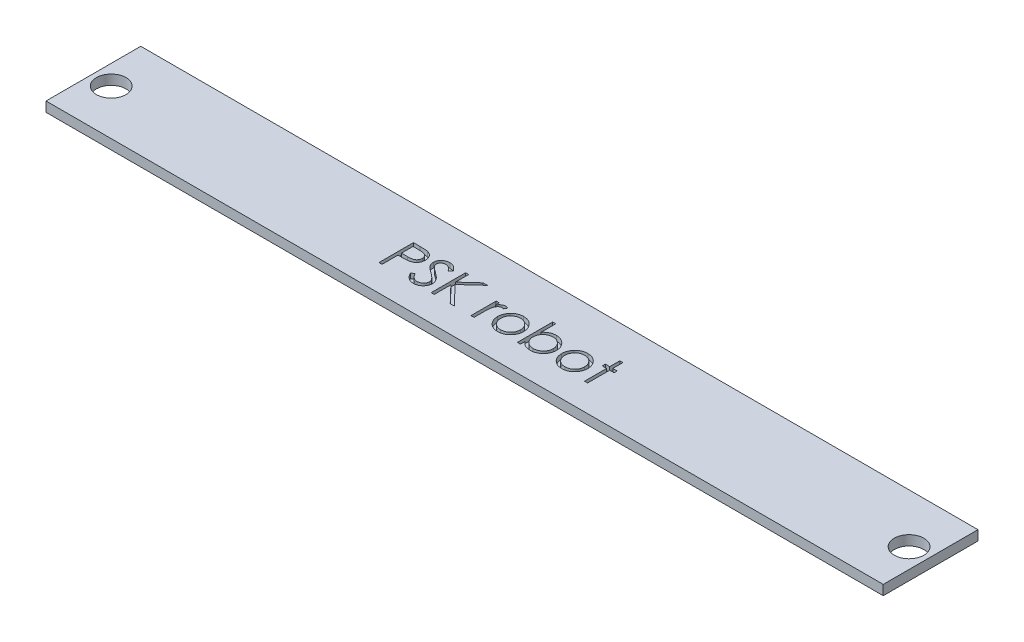
from build123d import *

# Parameters (mm, degrees)
SKETCH1_W           = 85
SKETCH1_H           = 9.62
SKETCH1_R           = 1.5
BOSS_EXTRUDE1_DEPTH = 1
CUT_EXTRUDE1_DEPTH  = 0.5


with BuildPart() as part:
    # Sketch1 → Boss-Extrude1 (new body)
    with BuildSketch(Plane(origin=(0, 0, 0), x_dir=(1, 0, 0), z_dir=(0, 1, 0))):
        Rectangle(SKETCH1_W, SKETCH1_H)
        with Locations(Location((-40.5, -0.19, 0), (0, 0, 270))):
            Circle(SKETCH1_R, mode=Mode.SUBTRACT)
        with Locations(Location((40.5, -0.19, 0), (0, 0, 270))):
            Circle(SKETCH1_R, mode=Mode.SUBTRACT)
    extrude(amount=BOSS_EXTRUDE1_DEPTH)

    # Sketch2 → Cut-Extrude1 (cut)
    # profile 1 of 8: a face of its own
    with BuildSketch(Plane(origin=(0, 1, 0), x_dir=(1, 0, 0), z_dir=(0, 1, 0))):
        with BuildLine():
            Line((-11.393174842, 1.388654774), (-10.706776605, 1.388654774))
            add(Edge.make_bspline(
                [(-10.706776605, 1.388654774), (-10.659565699, 1.388602878), (-10.569107506, 1.388503442), (-10.43939245, 1.385488696), (-10.321582718, 1.381462004), (-10.215932337, 1.375880111), (-10.122116239, 1.369283521), (-10.04055894, 1.360031481), (-9.970619383, 1.350371186), (-9.928712934, 1.340549779), (-9.909601124, 1.336070639)],
                knots=[0, 0, 0, 0, 1.415646017, 2.712440637, 3.8905458, 4.950247383, 5.884950622, 6.709939814, 7.411656543, 8, 8, 8, 8], degree=3))
            add(Edge.make_bspline(
                [(-9.909601124, 1.336070639), (-9.88540759, 1.329448689), (-9.837590613, 1.316360828), (-9.76868957, 1.290147104), (-9.703135724, 1.259064939), (-9.640704166, 1.223640999), (-9.582162083, 1.182355435), (-9.526636042, 1.136881817), (-9.474616062, 1.086170249), (-9.42639467, 1.030789509), (-9.382109872, 0.971669299), (-9.343980189, 0.907927069), (-9.312052962, 0.840635766), (-9.284669691, 0.769842194), (-9.264961236, 0.694951871), (-9.250114337, 0.616485159), (-9.240690709, 0.534450468), (-9.239788147, 0.478390601), (-9.239328688, 0.44985269)],
                knots=[0, 0, 0, 0, 0.999701418, 1.975846123, 2.934577507, 3.890451536, 4.834027766, 5.787354733, 6.749476667, 7.726910423, 8.712836071, 9.690891519, 10.682875813, 11.679750201, 12.712814741, 13.765529915, 14.8625177, 16, 16, 16, 16], degree=3))
            add(Edge.make_bspline(
                [(-9.239328688, 0.44985269), (-9.239750113, 0.421074914), (-9.240574659, 0.36476925), (-9.250470944, 0.282396462), (-9.263801136, 0.203678071), (-9.284298188, 0.128788621), (-9.311143861, 0.05817285), (-9.342635914, -0.009248382), (-9.380619444, -0.072328053), (-9.424264274, -0.131295171), (-9.472815868, -0.186205083), (-9.526068807, -0.236659878), (-9.583808099, -0.282364216), (-9.645850247, -0.32342056), (-9.712800096, -0.358876839), (-9.78364225, -0.390634144), (-9.858992466, -0.417305205), (-9.91113498, -0.431335266), (-9.937645996, -0.438468624)],
                knots=[0, 0, 0, 0, 1.121902311, 2.195077645, 3.232258892, 4.234102512, 5.217864754, 6.176164875, 7.132989551, 8.084763148, 9.034132444, 9.988522005, 10.94243251, 11.903244335, 12.886203696, 13.894208494, 14.929344452, 16, 16, 16, 16], degree=3))
            add(Edge.make_bspline(
                [(-9.937645996, -0.438468624), (-9.95957333, -0.443131605), (-10.007628357, -0.453350799), (-10.086771079, -0.464759256), (-10.178916465, -0.474496856), (-10.283938745, -0.481797994), (-10.40174365, -0.488048362), (-10.532394907, -0.493016456), (-10.676148985, -0.49574631), (-10.776420229, -0.495887103), (-10.828771797, -0.495960611)],
                knots=[0, 0, 0, 0, 0.601384939, 1.31797006, 2.144135048, 3.087295005, 4.142315834, 5.309527816, 6.595305764, 8, 8, 8, 8], degree=3))
            Line((-10.828771797, -0.495960611), (-11.079072278, -0.495960611))
            Line((-11.079072278, -0.495960611), (-11.079072278, -2.111345226))
            Line((-11.079072278, -2.111345226), (-11.393174842, -2.111345226))
            Line((-11.393174842, -2.111345226), (-11.393174842, 1.388654774))
        make_face()
        with BuildLine():
            Line((-11.079072278, 1.029680415), (-11.079072278, -0.136986252))
            Line((-11.079072278, -0.136986252), (-10.466291829, -0.144698592))
            add(Edge.make_bspline(
                [(-10.466291829, -0.144698592), (-10.436371903, -0.144714055), (-10.378612103, -0.144743907), (-10.29517588, -0.140758684), (-10.217766593, -0.136158151), (-10.146622017, -0.129422228), (-10.081710083, -0.11990097), (-10.022922554, -0.110289232), (-9.970715271, -0.09638387), (-9.909616069, -0.077660801), (-9.841532722, -0.045728185), (-9.767465173, 0.000621705), (-9.704694587, 0.059702413), (-9.65037629, 0.126130245), (-9.607270412, 0.200029374), (-9.57571442, 0.279098311), (-9.557173263, 0.36252616), (-9.554687069, 0.419614299), (-9.553431252, 0.448450447)],
                knots=[0, 0, 0, 0, 1.160613943, 2.240541288, 3.23993089, 4.169200891, 5.011653406, 5.7853311, 6.478053781, 7.106038997, 8.262395093, 9.384106736, 10.481365981, 11.59014053, 12.70357646, 13.786202915, 14.881775077, 16, 16, 16, 16], degree=3))
            add(Edge.make_bspline(
                [(-9.553431252, 0.448450447), (-9.554693899, 0.47658896), (-9.557203884, 0.532524842), (-9.575859747, 0.614503603), (-9.607209061, 0.692739307), (-9.650665655, 0.765712393), (-9.703406785, 0.831901197), (-9.764706128, 0.889398324), (-9.83441939, 0.935620027), (-9.899267621, 0.965453308), (-9.956868807, 0.983668584), (-10.006900766, 0.996413424), (-10.063391441, 1.00658903), (-10.12635922, 1.014828533), (-10.195316054, 1.021881994), (-10.270854369, 1.026667972), (-10.352688013, 1.029469428), (-10.409498583, 1.029608383), (-10.438948079, 1.029680415)],
                knots=[0, 0, 0, 0, 1.120700087, 2.227813068, 3.331159281, 4.466773991, 5.599788987, 6.693661531, 7.80175334, 8.91857717, 9.525282508, 10.207424825, 10.974604443, 11.810962634, 12.737642355, 13.736264703, 14.826523623, 16, 16, 16, 16], degree=3))
            Line((-10.438948079, 1.029680415), (-11.079072278, 1.029680415))
        make_face(mode=Mode.SUBTRACT)
    # profile 2 of 8: a face of its own
    with BuildSketch(Plane(origin=(0, 1, 0), x_dir=(1, 0, 0), z_dir=(0, 1, 0))):
        with BuildLine():
            Line((-8.880354329, -1.436164938), (-8.584480932, -1.258781124))
            add(Edge.make_bspline(
                [(-8.584480932, -1.258781124), (-8.556962694, -1.304845509), (-8.504238814, -1.393103093), (-8.416287455, -1.512361133), (-8.325154543, -1.61372329), (-8.23016521, -1.696599897), (-8.131899262, -1.761848784), (-8.029715208, -1.808051016), (-7.923957397, -1.836866991), (-7.851983576, -1.840367078), (-7.816051444, -1.842114457)],
                knots=[0, 0, 0, 0, 1.272034388, 2.437168799, 3.508375237, 4.49857839, 5.41946034, 6.295179144, 7.148887113, 8, 8, 8, 8], degree=3))
            add(Edge.make_bspline(
                [(-7.816051444, -1.842114457), (-7.785364584, -1.841259784), (-7.724527811, -1.839565394), (-7.634965568, -1.823284592), (-7.547983766, -1.798272463), (-7.465375128, -1.762451532), (-7.388279513, -1.719113046), (-7.320672818, -1.666766869), (-7.262226705, -1.608160663), (-7.21441759, -1.542778008), (-7.177737555, -1.47246086), (-7.149545487, -1.400284908), (-7.133900413, -1.32511634), (-7.131543659, -1.274505877), (-7.130354329, -1.248965419)],
                knots=[0, 0, 0, 0, 1.095163259, 2.171163733, 3.241058638, 4.321873601, 5.38011039, 6.391990106, 7.366004449, 8.327778327, 9.272591725, 10.192022065, 11.087607919, 12, 12, 12, 12], degree=3))
            add(Edge.make_bspline(
                [(-7.130354329, -1.248965419), (-7.13182864, -1.219824569), (-7.134825698, -1.16058548), (-7.160157178, -1.073185827), (-7.200006425, -0.986693257), (-7.236769069, -0.933191991), (-7.25585513, -0.905415739)],
                knots=[0, 0, 0, 0, 0.938893495, 1.908633276, 2.914225137, 4, 4, 4, 4], degree=3))
            add(Edge.make_bspline(
                [(-7.25585513, -0.905415739), (-7.271525745, -0.885368915), (-7.304424239, -0.843283117), (-7.360981751, -0.780637881), (-7.427347866, -0.716019462), (-7.501251421, -0.646960406), (-7.585384509, -0.576672609), (-7.677112024, -0.501804331), (-7.778775883, -0.425202754), (-7.850075379, -0.373830188), (-7.886864746, -0.34732279)],
                knots=[0, 0, 0, 0, 0.722233717, 1.516239348, 2.393582979, 3.351407094, 4.387010283, 5.505090956, 6.712668013, 8, 8, 8, 8], degree=3))
            add(Edge.make_bspline(
                [(-7.886864746, -0.34732279), (-7.923688742, -0.321094203), (-7.994093418, -0.27094714), (-8.092552001, -0.196522856), (-8.180596464, -0.128478987), (-8.25783548, -0.066174975), (-8.324235077, -0.00960237), (-8.380318488, 0.040695569), (-8.424657045, 0.08607913), (-8.449312626, 0.115520472), (-8.460382374, 0.128738908)],
                knots=[0, 0, 0, 0, 1.452282411, 2.77665338, 3.964542531, 5.026858415, 5.96415736, 6.766646006, 7.446254459, 8, 8, 8, 8], degree=3))
            add(Edge.make_bspline(
                [(-8.460382374, 0.128738908), (-8.475854919, 0.149339945), (-8.506283756, 0.189854649), (-8.546449761, 0.253179507), (-8.580588924, 0.318002772), (-8.607351256, 0.384498637), (-8.629887475, 0.451733566), (-8.645045406, 0.520584811), (-8.654536803, 0.59074343), (-8.655508789, 0.63795693), (-8.655995355, 0.661591472)],
                knots=[0, 0, 0, 0, 1.068054152, 2.10047183, 3.106115577, 4.101338837, 5.06977816, 6.043150881, 7.020423561, 8, 8, 8, 8], degree=3))
            add(Edge.make_bspline(
                [(-8.655995355, 0.661591472), (-8.654690146, 0.698621247), (-8.652107626, 0.771889311), (-8.630267108, 0.878920141), (-8.595794215, 0.981106558), (-8.547499327, 1.077436892), (-8.485241974, 1.165402873), (-8.413196, 1.24601636), (-8.327384513, 1.313784942), (-8.23323189, 1.372997001), (-8.130175518, 1.419342926), (-8.022184615, 1.454303906), (-7.909087543, 1.474113164), (-7.832484408, 1.476955929), (-7.793615547, 1.478398364)],
                knots=[0, 0, 0, 0, 1.005424448, 1.989358655, 2.955360095, 3.929531133, 4.905563448, 5.876582895, 6.856512386, 7.866279853, 8.892233794, 9.918561126, 10.94386622, 12, 12, 12, 12], degree=3))
            add(Edge.make_bspline(
                [(-7.793615547, 1.478398364), (-7.752371447, 1.476975812), (-7.670350095, 1.474146811), (-7.549700879, 1.449549279), (-7.433540163, 1.408848608), (-7.340096898, 1.36265995), (-7.266964137, 1.316528534), (-7.211191404, 1.27450871), (-7.154673953, 1.226133601), (-7.096955898, 1.171274355), (-7.039015239, 1.109427604), (-6.979991787, 1.041016915), (-6.919747518, 0.966460359), (-6.880991658, 0.913235858), (-6.86112356, 0.885950447)],
                knots=[0, 0, 0, 0, 1.286793592, 2.559021753, 3.825965368, 5.121522368, 5.803751409, 6.523245864, 7.299691795, 8.125521123, 9.008227632, 9.944561021, 10.946284179, 12, 12, 12, 12], degree=3))
            Line((-6.86112356, 0.885950447), (-7.145077887, 0.670706056))
            add(Edge.make_bspline(
                [(-7.145077887, 0.670706056), (-7.162223819, 0.692794746), (-7.195242876, 0.735332399), (-7.245372363, 0.794903715), (-7.292621011, 0.849320195), (-7.339171411, 0.896585323), (-7.382565042, 0.939287456), (-7.424682085, 0.975847213), (-7.464916436, 1.006622808), (-7.515633346, 1.039466368), (-7.579351065, 1.072022872), (-7.659335601, 1.09957195), (-7.742921876, 1.116127012), (-7.799851508, 1.118315899), (-7.828671637, 1.119424005)],
                knots=[0, 0, 0, 0, 1.181633172, 2.275549214, 3.290209073, 4.226197932, 5.078386478, 5.862611352, 6.581680152, 7.217281963, 8.414376989, 9.595101626, 10.782541182, 12, 12, 12, 12], degree=3))
            add(Edge.make_bspline(
                [(-7.828671637, 1.119424005), (-7.864828159, 1.118212305), (-7.934552607, 1.115875655), (-8.033542843, 1.09035567), (-8.122636768, 1.05017381), (-8.199189333, 0.993858832), (-8.26292631, 0.927137839), (-8.309031769, 0.850358984), (-8.336781933, 0.765576581), (-8.340168213, 0.706434925), (-8.341892791, 0.67631503)],
                knots=[0, 0, 0, 0, 1.14458467, 2.207223713, 3.21896685, 4.227309161, 5.202851033, 6.127160689, 7.046193047, 8, 8, 8, 8], degree=3))
            add(Edge.make_bspline(
                [(-8.341892791, 0.67631503), (-8.341499664, 0.657563552), (-8.340712768, 0.620029932), (-8.32973797, 0.56457851), (-8.315638641, 0.509267171), (-8.293296009, 0.454344588), (-8.262450706, 0.398850229), (-8.22194553, 0.341828491), (-8.170932218, 0.282776783), (-8.131855206, 0.244369409), (-8.11122372, 0.224091472)],
                knots=[0, 0, 0, 0, 0.858281714, 1.717966888, 2.583508476, 3.4729293, 4.427298488, 5.488583878, 6.674047936, 8, 8, 8, 8], degree=3))
            add(Edge.make_bspline(
                [(-8.11122372, 0.224091472), (-8.103562348, 0.217254447), (-8.085360681, 0.201011238), (-8.052084755, 0.174418958), (-8.008141957, 0.141616185), (-7.954679755, 0.101028869), (-7.890712394, 0.053947407), (-7.816232838, 0.000973795), (-7.732071305, -0.059611664), (-7.672349389, -0.101969205), (-7.640770996, -0.12436606)],
                knots=[0, 0, 0, 0, 0.420754252, 0.999615792, 1.744751191, 2.668019286, 3.750313428, 4.999500688, 6.413464383, 8, 8, 8, 8], degree=3))
            add(Edge.make_bspline(
                [(-7.640770996, -0.12436606), (-7.602785082, -0.152007419), (-7.529230626, -0.205531081), (-7.424573046, -0.285946761), (-7.329679238, -0.364594529), (-7.244216034, -0.440972137), (-7.167339126, -0.51450023), (-7.099901405, -0.58606341), (-7.041215725, -0.655148983), (-6.978036507, -0.743721558), (-6.913478687, -0.852502643), (-6.85803718, -0.985780881), (-6.823078832, -1.119577202), (-6.818507317, -1.209504038), (-6.816251765, -1.253873271)],
                knots=[0, 0, 0, 0, 1.163667725, 2.253281268, 3.268753668, 4.215851969, 5.092017293, 5.902905408, 6.650798638, 7.335211899, 8.59617414, 9.77448103, 10.901945474, 12, 12, 12, 12], degree=3))
            add(Edge.make_bspline(
                [(-6.816251765, -1.253873271), (-6.816908903, -1.285251636), (-6.818210418, -1.34739902), (-6.833171332, -1.438654097), (-6.855090997, -1.527284966), (-6.888128231, -1.612196079), (-6.928451389, -1.694940841), (-6.979617637, -1.773348742), (-7.038925322, -1.84915514), (-7.106959087, -1.920338632), (-7.181404989, -1.985684828), (-7.260088684, -2.043813889), (-7.343138957, -2.092282213), (-7.430105273, -2.131833055), (-7.52100761, -2.162766572), (-7.615815394, -2.185179441), (-7.714684905, -2.198935152), (-7.781885387, -2.200362914), (-7.816051444, -2.201088816)],
                knots=[0, 0, 0, 0, 0.983748083, 1.948392443, 2.894712957, 3.844097841, 4.80183111, 5.778335162, 6.776009319, 7.81870978, 8.863265674, 9.881300176, 10.883814829, 11.87499822, 12.874611388, 13.892143829, 14.928324115, 16, 16, 16, 16], degree=3))
            add(Edge.make_bspline(
                [(-7.816051444, -2.201088816), (-7.842486787, -2.200577634), (-7.895024547, -2.199561709), (-7.972734029, -2.190580429), (-8.048873619, -2.177873325), (-8.122487901, -2.157699255), (-8.194525312, -2.133222278), (-8.264672547, -2.103083945), (-8.332963601, -2.066966744), (-8.399781183, -2.025671719), (-8.464955358, -1.977613975), (-8.527874826, -1.921640478), (-8.590604011, -1.859294973), (-8.651291408, -1.78888441), (-8.711164552, -1.711546327), (-8.769042962, -1.626557144), (-8.826124679, -1.53437979), (-8.861940147, -1.469514704), (-8.880354329, -1.436164938)],
                knots=[0, 0, 0, 0, 0.915332311, 1.819136955, 2.706846663, 3.586547465, 4.459518054, 5.340707479, 6.227863349, 7.133153174, 8.059268498, 9.028702269, 10.047606654, 11.120612155, 12.245963614, 13.433783089, 14.680604001, 16, 16, 16, 16], degree=3))
        make_face()
    # profile 3 of 8: a face of its own
    with BuildSketch(Plane(origin=(0, 1, 0), x_dir=(1, 0, 0), z_dir=(0, 1, 0))):
        Polygon((-6.098303047, 1.388654774), (-5.784200483, 1.388654774), (-5.784200483, 0.055822242), (-4.325166028, 1.388654774), (-3.877149201, 1.388654774), (-5.597000964, -0.181858047), (-3.742533816, -2.111345226), (-4.161103528, -2.111345226), (-5.784200483, -0.422342822), (-5.784200483, -2.111345226), (-6.098303047, -2.111345226), align=None)
    # profile 4 of 8: a face of its own
    with BuildSketch(Plane(origin=(0, 1, 0), x_dir=(1, 0, 0), z_dir=(0, 1, 0))):
        with BuildLine():
            Line((-2.059841509, 0.446347081), (-1.745738944, 0.446347081))
            Line((-1.745738944, 0.446347081), (-1.745738944, 0.069844678))
            add(Edge.make_bspline(
                [(-1.745738944, 0.069844678), (-1.722550186, 0.104900506), (-1.678201865, 0.171944505), (-1.604488935, 0.260613806), (-1.528985604, 0.334028853), (-1.451330417, 0.392532372), (-1.370952317, 0.43634549), (-1.289615365, 0.468438525), (-1.206039895, 0.487415841), (-1.149877971, 0.4899495), (-1.121740547, 0.491218876)],
                knots=[0, 0, 0, 0, 1.2804753, 2.448899062, 3.506932113, 4.484331642, 5.4025378, 6.288909075, 7.142734305, 8, 8, 8, 8], degree=3))
            add(Edge.make_bspline(
                [(-1.121740547, 0.491218876), (-1.099914221, 0.49002835), (-1.055005135, 0.487578764), (-0.987022545, 0.470367939), (-0.916979094, 0.442889917), (-0.871836706, 0.417049694), (-0.848303047, 0.403578652)],
                knots=[0, 0, 0, 0, 0.901110191, 1.854092781, 2.881294221, 4, 4, 4, 4], degree=3))
            Line((-0.848303047, 0.403578652), (-1.020779009, 0.131543396))
            add(Edge.make_bspline(
                [(-1.020779009, 0.131543396), (-1.03588803, 0.138283662), (-1.064567844, 0.151077977), (-1.10652241, 0.166219987), (-1.145203747, 0.175135903), (-1.169847306, 0.176486621), (-1.1813359, 0.177116312)],
                knots=[0, 0, 0, 0, 1.180555205, 2.24091978, 3.179933427, 4, 4, 4, 4], degree=3))
            add(Edge.make_bspline(
                [(-1.1813359, 0.177116312), (-1.206541633, 0.175436275), (-1.257954023, 0.172009486), (-1.333438522, 0.145070678), (-1.406685728, 0.101545438), (-1.46485739, 0.053274326), (-1.509899643, 0.006726528), (-1.542039869, -0.033921874), (-1.571522616, -0.079500506), (-1.599692836, -0.129230189), (-1.62535913, -0.183960036), (-1.649313799, -0.243143249), (-1.670972662, -0.306848378), (-1.683322907, -0.351230898), (-1.689649201, -0.373965419)],
                knots=[0, 0, 0, 0, 1.125678352, 2.296057538, 3.5422874, 4.923748041, 5.663163013, 6.437101912, 7.23742474, 8.08941207, 8.991984279, 9.93940061, 10.944477711, 12, 12, 12, 12], degree=3))
            add(Edge.make_bspline(
                [(-1.689649201, -0.373965419), (-1.694381594, -0.394242592), (-1.704863486, -0.439154991), (-1.715055024, -0.514503515), (-1.725124542, -0.603527174), (-1.73222116, -0.706473767), (-1.738799202, -0.823086211), (-1.742509284, -0.953542157), (-1.745612425, -1.097975508), (-1.745695492, -1.198949861), (-1.745738944, -1.251769906)],
                knots=[0, 0, 0, 0, 0.566838948, 1.255505196, 2.06880316, 3.007127437, 4.065329342, 5.249902469, 6.561414163, 8, 8, 8, 8], degree=3))
            Line((-1.745738944, -1.251769906), (-1.745738944, -2.111345226))
            Line((-1.745738944, -2.111345226), (-2.059841509, -2.111345226))
            Line((-2.059841509, -2.111345226), (-2.059841509, 0.446347081))
        make_face()
    # profile 5 of 8: a face of its own
    with BuildSketch(Plane(origin=(0, 1, 0), x_dir=(1, 0, 0), z_dir=(0, 1, 0))):
        with BuildLine():
            add(Edge.make_bspline(
                [(0.70117612, 0.491218876), (0.749167393, 0.490196985), (0.84326655, 0.488193306), (0.981074436, 0.466778341), (1.112619572, 0.434030976), (1.238405764, 0.388759414), (1.35682206, 0.328077464), (1.469593304, 0.255668173), (1.576410313, 0.169885579), (1.640433342, 0.103527511), (1.672930927, 0.069844678)],
                knots=[0, 0, 0, 0, 1.054011418, 2.066658804, 3.057071809, 4.030435133, 4.997543892, 5.974964718, 6.972108034, 8, 8, 8, 8], degree=3))
            add(Edge.make_bspline(
                [(1.672930927, 0.069844678), (1.700912881, 0.037630692), (1.756335262, -0.02617385), (1.82740098, -0.129629463), (1.888622541, -0.236769564), (1.937685502, -0.349016891), (1.976370525, -0.465391562), (2.003836222, -0.586293573), (2.020173156, -0.71145592), (2.022376123, -0.796459758), (2.023491825, -0.83951029)],
                knots=[0, 0, 0, 0, 1.025258237, 2.030674902, 3.01204498, 3.988269485, 4.97094183, 5.956517959, 6.965070386, 8, 8, 8, 8], degree=3))
            add(Edge.make_bspline(
                [(2.023491825, -0.83951029), (2.022510487, -0.882810348), (2.020571319, -0.968373281), (2.002227703, -1.094392647), (1.973696617, -1.21658747), (1.932864779, -1.334446164), (1.880506669, -1.448328991), (1.816615982, -1.55773854), (1.740744365, -1.662890674), (1.654740368, -1.762892512), (1.559688492, -1.855058727), (1.456572344, -1.935386996), (1.34741831, -2.00420852), (1.230774957, -2.059644936), (1.10770747, -2.103354636), (0.977950402, -2.134054653), (0.841705331, -2.152616337), (0.74867811, -2.15499991), (0.70117612, -2.156217021)],
                knots=[0, 0, 0, 0, 0.998656419, 1.973391657, 2.932242238, 3.890759089, 4.846373663, 5.82037756, 6.809684879, 7.83454468, 8.860553229, 9.859544525, 10.845671541, 11.83227036, 12.833544569, 13.85385346, 14.904124723, 16, 16, 16, 16], degree=3))
            add(Edge.make_bspline(
                [(0.70117612, -2.156217021), (0.6534414, -2.154995825), (0.55995054, -2.15260405), (0.423224559, -2.134126768), (0.29323494, -2.103368785), (0.170006341, -2.059501292), (0.052861494, -2.004206749), (-0.056925003, -1.935595059), (-0.160124918, -1.855034904), (-0.255196903, -1.762898967), (-0.341195508, -1.66288901), (-0.417068516, -1.557738972), (-0.480958843, -1.448328878), (-0.533317046, -1.334446194), (-0.574148859, -1.216587462), (-0.602679952, -1.094392649), (-0.621023567, -0.968373281), (-0.622962735, -0.882810348), (-0.623944073, -0.83951029)],
                knots=[0, 0, 0, 0, 1.099876186, 2.154163076, 3.173186993, 4.173200201, 5.163417411, 6.152872554, 7.150605724, 8.17532212, 9.198891216, 10.186952605, 11.159729845, 12.11414092, 13.071450619, 14.029093627, 15.002601286, 16, 16, 16, 16], degree=3))
            add(Edge.make_bspline(
                [(-0.623944073, -0.83951029), (-0.622820762, -0.796693744), (-0.620596801, -0.711924342), (-0.604276292, -0.586997281), (-0.576917735, -0.466299892), (-0.538186339, -0.350374416), (-0.488671148, -0.23861898), (-0.42830986, -0.131214149), (-0.356519227, -0.028226349), (-0.301317276, 0.035495731), (-0.273383175, 0.067741312)],
                knots=[0, 0, 0, 0, 1.031353054, 2.041901799, 3.029428768, 4.008703097, 4.981709435, 5.96992636, 6.972712378, 8, 8, 8, 8], degree=3))
            add(Edge.make_bspline(
                [(-0.273383175, 0.067741312), (-0.240934584, 0.101716251), (-0.17711872, 0.168533948), (-0.069769993, 0.254066472), (0.042723829, 0.327982546), (0.162448755, 0.387458761), (0.288131613, 0.434297279), (0.420350855, 0.466862794), (0.558626371, 0.488116149), (0.653185992, 0.490174327), (0.70117612, 0.491218876)],
                knots=[0, 0, 0, 0, 1.027980169, 2.021703884, 2.998553061, 3.971491411, 4.943284454, 5.930300938, 6.949603206, 8, 8, 8, 8], degree=3))
        make_face()
        with BuildLine():
            add(Edge.make_bspline(
                [(0.699773876, 0.177116312), (0.665836265, 0.176151721), (0.598837136, 0.174247438), (0.500217551, 0.159763533), (0.405277397, 0.136816029), (0.313836553, 0.104211973), (0.226203381, 0.062113074), (0.142293979, 0.010404714), (0.061861539, -0.050228243), (-0.013520525, -0.119690914), (-0.082702837, -0.195569909), (-0.143180814, -0.276418268), (-0.19460592, -0.360924614), (-0.237446079, -0.449176825), (-0.269353267, -0.542069239), (-0.292526289, -0.63854987), (-0.30699653, -0.738815287), (-0.308882908, -0.806976305), (-0.309841509, -0.841613656)],
                knots=[0, 0, 0, 0, 1.021534396, 2.016698045, 2.994645724, 3.958388632, 4.93408049, 5.916473867, 6.921342795, 7.962252576, 8.998418191, 10.008913653, 10.997312074, 11.973003931, 12.956656626, 13.948281152, 14.957379055, 16, 16, 16, 16], degree=3))
            add(Edge.make_bspline(
                [(-0.309841509, -0.841613656), (-0.308234685, -0.886365683), (-0.30504544, -0.975190088), (-0.279110204, -1.106001211), (-0.235723924, -1.231583063), (-0.177136644, -1.351199449), (-0.103730426, -1.461871727), (-0.017243359, -1.560543212), (0.081396341, -1.645729023), (0.191012841, -1.716409869), (0.309367159, -1.772569624), (0.434623481, -1.8123686), (0.565264175, -1.838240292), (0.654544906, -1.840811767), (0.699773876, -1.842114457)],
                knots=[0, 0, 0, 0, 1.016792936, 2.018143844, 3.017858371, 4.030088057, 5.03801393, 6.028138512, 7.003788237, 7.991172063, 8.984598303, 9.972568034, 10.972917682, 12, 12, 12, 12], degree=3))
            add(Edge.make_bspline(
                [(0.699773876, -1.842114457), (0.745000245, -1.840804177), (0.834275841, -1.83821772), (0.964735018, -1.8124989), (1.08964899, -1.772395239), (1.207880377, -1.71647303), (1.317446981, -1.645460615), (1.416796102, -1.561024238), (1.502544713, -1.461610386), (1.575878318, -1.351052858), (1.635425061, -1.231768505), (1.678608263, -1.105978033), (1.704605848, -0.975195991), (1.707786677, -0.886367661), (1.709389261, -0.841613656)],
                knots=[0, 0, 0, 0, 1.02726834, 2.027799167, 3.010890988, 4.004497153, 4.992059811, 5.971914811, 6.958719428, 7.966827853, 8.981595046, 9.981490638, 10.983022906, 12, 12, 12, 12], degree=3))
            add(Edge.make_bspline(
                [(1.709389261, -0.841613656), (1.708430991, -0.806976098), (1.706545262, -0.738814672), (1.692070297, -0.638552219), (1.668914758, -0.542060622), (1.63694314, -0.449208619), (1.594289126, -0.360696115), (1.541872333, -0.276666387), (1.481641308, -0.195289841), (1.411624187, -0.119936201), (1.336320809, -0.050201164), (1.255855771, 0.010428225), (1.172070792, 0.061885821), (1.08469221, 0.104572061), (0.993239642, 0.136519402), (0.898432513, 0.159896033), (0.800233703, 0.17418623), (0.73347466, 0.176133371), (0.699773876, 0.177116312)],
                knots=[0, 0, 0, 0, 1.042956736, 2.052379634, 3.044323526, 4.02829302, 5.004299113, 5.996692471, 7.007513377, 8.048758398, 9.090003419, 10.095195979, 11.07790575, 12.047570684, 13.018257071, 13.989683339, 14.985167495, 16, 16, 16, 16], degree=3))
        make_face(mode=Mode.SUBTRACT)
    # profile 6 of 8: a face of its own
    with BuildSketch(Plane(origin=(0, 1, 0), x_dir=(1, 0, 0), z_dir=(0, 1, 0))):
        with BuildLine():
            Line((2.651696953, -2.111345226), (2.651696953, 1.478398364))
            Line((2.651696953, 1.478398364), (2.965799517, 1.478398364))
            Line((2.965799517, 1.478398364), (2.965799517, -0.017795547))
            add(Edge.make_bspline(
                [(2.965799517, -0.017795547), (3.001192936, 0.022962385), (3.070246956, 0.10248279), (3.186023407, 0.20633044), (3.307428976, 0.294382918), (3.435387232, 0.366969036), (3.570080165, 0.422242643), (3.710812274, 0.462665033), (3.857943315, 0.487051936), (3.958262489, 0.489818009), (4.009068748, 0.491218876)],
                knots=[0, 0, 0, 0, 1.077089805, 2.101446609, 3.097517232, 4.067117542, 5.031729543, 5.997785507, 6.985986182, 8, 8, 8, 8], degree=3))
            add(Edge.make_bspline(
                [(4.009068748, 0.491218876), (4.054234886, 0.489978648), (4.143536038, 0.487526506), (4.274818185, 0.46889201), (4.40113146, 0.438674208), (4.522407108, 0.396782029), (4.63807924, 0.341199052), (4.749138297, 0.274657744), (4.855015282, 0.195419415), (4.954070167, 0.104821104), (5.045364054, 0.006464481), (5.125276564, -0.098715834), (5.19277626, -0.209190924), (5.248607552, -0.324590987), (5.291778605, -0.445387338), (5.321520873, -0.571461536), (5.340414337, -0.702689555), (5.342794583, -0.792002359), (5.344004645, -0.837406925)],
                knots=[0, 0, 0, 0, 1.034377878, 2.045141349, 3.03070803, 4.00595497, 4.978199603, 5.965204761, 6.967410914, 8.002051993, 9.036360596, 10.037508045, 11.022711142, 11.997267194, 12.969246472, 13.954813154, 14.960274251, 16, 16, 16, 16], degree=3))
            add(Edge.make_bspline(
                [(5.344004645, -0.837406925), (5.342768205, -0.882106943), (5.340330139, -0.970248338), (5.321708831, -1.099954894), (5.290962566, -1.224793593), (5.247001383, -1.344441851), (5.191736444, -1.459461764), (5.122625168, -1.568542168), (5.042814169, -1.673581144), (4.95048302, -1.771204775), (4.850569467, -1.861438175), (4.743655225, -1.93984404), (4.632433303, -2.00756116), (4.515170191, -2.061216608), (4.393602149, -2.104617529), (4.266426762, -2.13473522), (4.134363534, -2.152308275), (4.044644646, -2.154903842), (3.999253043, -2.156217021)],
                knots=[0, 0, 0, 0, 1.024244038, 2.01964794, 2.996620209, 3.965911562, 4.936179293, 5.91563013, 6.920572822, 7.955171681, 8.990768464, 10.002129126, 10.989675881, 11.969873457, 12.952483066, 13.943799762, 14.959703725, 16, 16, 16, 16], degree=3))
            add(Edge.make_bspline(
                [(3.999253043, -2.156217021), (3.94728793, -2.154776413), (3.845393406, -2.151951631), (3.696340741, -2.128532652), (3.555259191, -2.088671042), (3.420541643, -2.035109286), (3.29411392, -1.962580632), (3.175173338, -1.872623882), (3.064469965, -1.763756745), (2.99925315, -1.680695255), (2.965799517, -1.638088015)],
                knots=[0, 0, 0, 0, 1.035807596, 2.031038093, 2.998900396, 3.954262848, 4.914341711, 5.895762244, 6.92060972, 8, 8, 8, 8], degree=3))
            Line((2.965799517, -1.638088015), (2.965799517, -2.111345226))
            Line((2.965799517, -2.111345226), (2.651696953, -2.111345226))
        make_face()
        with BuildLine():
            add(Edge.make_bspline(
                [(3.996448556, -1.842114457), (4.042362908, -1.840480828), (4.132990537, -1.837256305), (4.266034327, -1.812082681), (4.393348537, -1.770198568), (4.514291619, -1.712914859), (4.626970931, -1.640892824), (4.727623565, -1.553746654), (4.817103275, -1.454245139), (4.891755051, -1.342011446), (4.954081295, -1.222560477), (4.996894571, -1.096906175), (5.025614293, -0.968411386), (5.028466591, -0.881265342), (5.029902081, -0.837406925)],
                knots=[0, 0, 0, 0, 1.031910345, 2.036826888, 3.032245421, 4.038315463, 5.03827337, 6.029480047, 7.023177075, 8.037597977, 9.052889626, 10.043399556, 11.015292101, 12, 12, 12, 12], degree=3))
            add(Edge.make_bspline(
                [(5.029902081, -0.837406925), (5.028014337, -0.793591383), (5.024246386, -0.706135222), (4.997871603, -0.576485555), (4.951813813, -0.45089793), (4.89069579, -0.329719942), (4.814827805, -0.216712141), (4.725821841, -0.115222014), (4.623940035, -0.02766203), (4.511116616, 0.045328041), (4.390936425, 0.104887594), (4.264445792, 0.14573262), (4.134287669, 0.172470807), (4.045892176, 0.175559935), (4.001356408, 0.177116312)],
                knots=[0, 0, 0, 0, 0.984795267, 1.965658976, 2.959410029, 3.983795688, 5.009594896, 6.01088574, 7.009236619, 8.019050059, 9.024672985, 10.014834719, 10.999826153, 12, 12, 12, 12], degree=3))
            add(Edge.make_bspline(
                [(4.001356408, 0.177116312), (3.955888901, 0.175560815), (3.865645124, 0.172473468), (3.732476902, 0.145685644), (3.602413618, 0.104638032), (3.478126086, 0.045706683), (3.362272031, -0.026404777), (3.258659419, -0.111144977), (3.169327861, -0.207924885), (3.09578409, -0.316430687), (3.037379291, -0.433615722), (2.995595543, -0.558627925), (2.970595897, -0.690809238), (2.967417764, -0.781442444), (2.965799517, -0.82759122)],
                knots=[0, 0, 0, 0, 1.016820015, 2.018181405, 3.029022337, 4.06341356, 5.088169224, 6.076823655, 7.05054209, 8.02560866, 9.001194327, 9.972267242, 10.967515442, 12, 12, 12, 12], degree=3))
            add(Edge.make_bspline(
                [(2.965799517, -0.82759122), (2.966759188, -0.862929038), (2.968648123, -0.932485048), (2.983078491, -1.034612738), (3.006034153, -1.132345831), (3.038377647, -1.225790826), (3.080878882, -1.314417266), (3.132089147, -1.398913346), (3.193040794, -1.478516624), (3.261947383, -1.553031945), (3.337909764, -1.620841359), (3.419432883, -1.679619584), (3.504850813, -1.730233774), (3.595140784, -1.770578617), (3.689252075, -1.803505137), (3.788150416, -1.825238883), (3.89082184, -1.840213922), (3.960868937, -1.841474275), (3.996448556, -1.842114457)],
                knots=[0, 0, 0, 0, 1.050331198, 2.067384183, 3.060053655, 4.031335885, 5.001026174, 5.976994447, 6.963687968, 7.976578778, 8.990422448, 9.985569286, 10.960374351, 11.936812464, 12.921228065, 13.919088064, 14.943024695, 16, 16, 16, 16], degree=3))
        make_face(mode=Mode.SUBTRACT)
    # profile 7 of 8: a face of its own
    with BuildSketch(Plane(origin=(0, 1, 0), x_dir=(1, 0, 0), z_dir=(0, 1, 0))):
        with BuildLine():
            add(Edge.make_bspline(
                [(7.207586376, 0.491218876), (7.255577649, 0.490196985), (7.349676806, 0.488193306), (7.487484692, 0.466778341), (7.619029828, 0.434030976), (7.74481602, 0.388759414), (7.863232316, 0.328077464), (7.97600356, 0.255668173), (8.082820569, 0.169885579), (8.146843598, 0.103527511), (8.179341184, 0.069844678)],
                knots=[0, 0, 0, 0, 1.054011418, 2.066658804, 3.057071809, 4.030435133, 4.997543892, 5.974964718, 6.972108034, 8, 8, 8, 8], degree=3))
            add(Edge.make_bspline(
                [(8.179341184, 0.069844678), (8.207323138, 0.037630692), (8.262745518, -0.02617385), (8.333811237, -0.129629463), (8.395032797, -0.236769564), (8.444095758, -0.349016891), (8.482780782, -0.465391562), (8.510246478, -0.586293573), (8.526583413, -0.71145592), (8.52878638, -0.796459758), (8.529902081, -0.83951029)],
                knots=[0, 0, 0, 0, 1.025258237, 2.030674902, 3.01204498, 3.988269485, 4.97094183, 5.956517959, 6.965070386, 8, 8, 8, 8], degree=3))
            add(Edge.make_bspline(
                [(8.529902081, -0.83951029), (8.528920744, -0.882810348), (8.526981576, -0.968373281), (8.508637959, -1.094392647), (8.480106873, -1.21658747), (8.439275035, -1.334446164), (8.386916926, -1.448328991), (8.323026238, -1.55773854), (8.247154621, -1.662890674), (8.161150624, -1.762892512), (8.066098748, -1.855058727), (7.9629826, -1.935386996), (7.853828566, -2.00420852), (7.737185213, -2.059644936), (7.614117726, -2.103354636), (7.484360658, -2.134054653), (7.348115588, -2.152616337), (7.255088366, -2.15499991), (7.207586376, -2.156217021)],
                knots=[0, 0, 0, 0, 0.998656419, 1.973391657, 2.932242238, 3.890759089, 4.846373663, 5.82037756, 6.809684879, 7.83454468, 8.860553229, 9.859544525, 10.845671541, 11.83227036, 12.833544569, 13.85385346, 14.904124723, 16, 16, 16, 16], degree=3))
            add(Edge.make_bspline(
                [(7.207586376, -2.156217021), (7.159851657, -2.154995825), (7.066360797, -2.15260405), (6.929634815, -2.134126768), (6.799645196, -2.103368785), (6.676416597, -2.059501292), (6.559271751, -2.004206749), (6.449485254, -1.935595059), (6.346285338, -1.855034904), (6.251213354, -1.762898967), (6.165214748, -1.66288901), (6.08934174, -1.557738972), (6.025451414, -1.448328878), (5.97309321, -1.334446194), (5.932261397, -1.216587462), (5.903730304, -1.094392649), (5.88538669, -0.968373281), (5.883447521, -0.882810348), (5.882466184, -0.83951029)],
                knots=[0, 0, 0, 0, 1.099876186, 2.154163076, 3.173186993, 4.173200201, 5.163417411, 6.152872554, 7.150605724, 8.17532212, 9.198891216, 10.186952605, 11.159729845, 12.11414092, 13.071450619, 14.029093627, 15.002601286, 16, 16, 16, 16], degree=3))
            add(Edge.make_bspline(
                [(5.882466184, -0.83951029), (5.883589494, -0.796693744), (5.885813456, -0.711924342), (5.902133965, -0.586997281), (5.929492521, -0.466299892), (5.968223918, -0.350374416), (6.017739108, -0.23861898), (6.078100396, -0.131214149), (6.149891029, -0.028226349), (6.20509298, 0.035495731), (6.233027081, 0.067741312)],
                knots=[0, 0, 0, 0, 1.031353054, 2.041901799, 3.029428768, 4.008703097, 4.981709435, 5.96992636, 6.972712378, 8, 8, 8, 8], degree=3))
            add(Edge.make_bspline(
                [(6.233027081, 0.067741312), (6.265475672, 0.101716251), (6.329291536, 0.168533948), (6.436640264, 0.254066472), (6.549134085, 0.327982546), (6.668859011, 0.387458761), (6.794541869, 0.434297279), (6.926761112, 0.466862794), (7.065036627, 0.488116149), (7.159596248, 0.490174327), (7.207586376, 0.491218876)],
                knots=[0, 0, 0, 0, 1.027980169, 2.021703884, 2.998553061, 3.971491411, 4.943284454, 5.930300938, 6.949603206, 8, 8, 8, 8], degree=3))
        make_face()
        with BuildLine():
            add(Edge.make_bspline(
                [(7.206184132, 0.177116312), (7.172246521, 0.176151721), (7.105247393, 0.174247438), (7.006627808, 0.159763533), (6.911687654, 0.136816029), (6.82024681, 0.104211973), (6.732613637, 0.062113074), (6.648704235, 0.010404714), (6.568271795, -0.050228243), (6.492889732, -0.119690914), (6.423707419, -0.195569909), (6.363229443, -0.276418268), (6.311804337, -0.360924614), (6.268964178, -0.449176825), (6.237056989, -0.542069239), (6.213883967, -0.63854987), (6.199413727, -0.738815287), (6.197527348, -0.806976305), (6.196568748, -0.841613656)],
                knots=[0, 0, 0, 0, 1.021534396, 2.016698045, 2.994645724, 3.958388632, 4.93408049, 5.916473867, 6.921342795, 7.962252576, 8.998418191, 10.008913653, 10.997312074, 11.973003931, 12.956656626, 13.948281152, 14.957379055, 16, 16, 16, 16], degree=3))
            add(Edge.make_bspline(
                [(6.196568748, -0.841613656), (6.198175572, -0.886365683), (6.201364816, -0.975190088), (6.227300052, -1.106001211), (6.270686332, -1.231583063), (6.329273612, -1.351199449), (6.402679831, -1.461871727), (6.489166897, -1.560543212), (6.587806598, -1.645729023), (6.697423098, -1.716409869), (6.815777416, -1.772569624), (6.941033737, -1.8123686), (7.071674431, -1.838240292), (7.160955162, -1.840811767), (7.206184132, -1.842114457)],
                knots=[0, 0, 0, 0, 1.016792936, 2.018143844, 3.017858371, 4.030088057, 5.03801393, 6.028138512, 7.003788237, 7.991172063, 8.984598303, 9.972568034, 10.972917682, 12, 12, 12, 12], degree=3))
            add(Edge.make_bspline(
                [(7.206184132, -1.842114457), (7.251410501, -1.840804177), (7.340686097, -1.83821772), (7.471145274, -1.8124989), (7.596059246, -1.772395239), (7.714290634, -1.71647303), (7.823857237, -1.645460615), (7.923206358, -1.561024238), (8.00895497, -1.461610386), (8.082288574, -1.351052858), (8.141835317, -1.231768505), (8.185018519, -1.105978033), (8.211016105, -0.975195991), (8.214196934, -0.886367661), (8.215799517, -0.841613656)],
                knots=[0, 0, 0, 0, 1.02726834, 2.027799167, 3.010890988, 4.004497153, 4.992059811, 5.971914811, 6.958719428, 7.966827853, 8.981595046, 9.981490638, 10.983022906, 12, 12, 12, 12], degree=3))
            add(Edge.make_bspline(
                [(8.215799517, -0.841613656), (8.214841247, -0.806976098), (8.212955518, -0.738814672), (8.198480554, -0.638552219), (8.175325014, -0.542060622), (8.143353397, -0.449208619), (8.100699383, -0.360696115), (8.04828259, -0.276666387), (7.988051564, -0.195289841), (7.918034443, -0.119936201), (7.842731066, -0.050201164), (7.762266027, 0.010428225), (7.678481049, 0.061885821), (7.591102466, 0.104572061), (7.499649898, 0.136519402), (7.404842769, 0.159896033), (7.306643959, 0.17418623), (7.239884916, 0.176133371), (7.206184132, 0.177116312)],
                knots=[0, 0, 0, 0, 1.042956736, 2.052379634, 3.044323526, 4.02829302, 5.004299113, 5.996692471, 7.007513377, 8.048758398, 9.090003419, 10.095195979, 11.07790575, 12.047570684, 13.018257071, 13.989683339, 14.985167495, 16, 16, 16, 16], degree=3))
        make_face(mode=Mode.SUBTRACT)
    # profile 8 of 8: a face of its own
    with BuildSketch(Plane(origin=(0, 1, 0), x_dir=(1, 0, 0), z_dir=(0, 1, 0))):
        Polygon((9.472209774, 1.478398364), (9.786312338, 1.478398364), (9.786312338, 0.446347081), (10.235030286, 0.446347081), (10.235030286, 0.132244517), (9.786312338, 0.132244517), (9.786312338, -2.111345226), (9.472209774, -2.111345226), (9.472209774, 0.132244517), (9.023491825, 0.132244517), (9.023491825, 0.446347081), (9.472209774, 0.446347081), align=None)
    extrude(amount=-CUT_EXTRUDE1_DEPTH, mode=Mode.SUBTRACT)


solid = part.part
